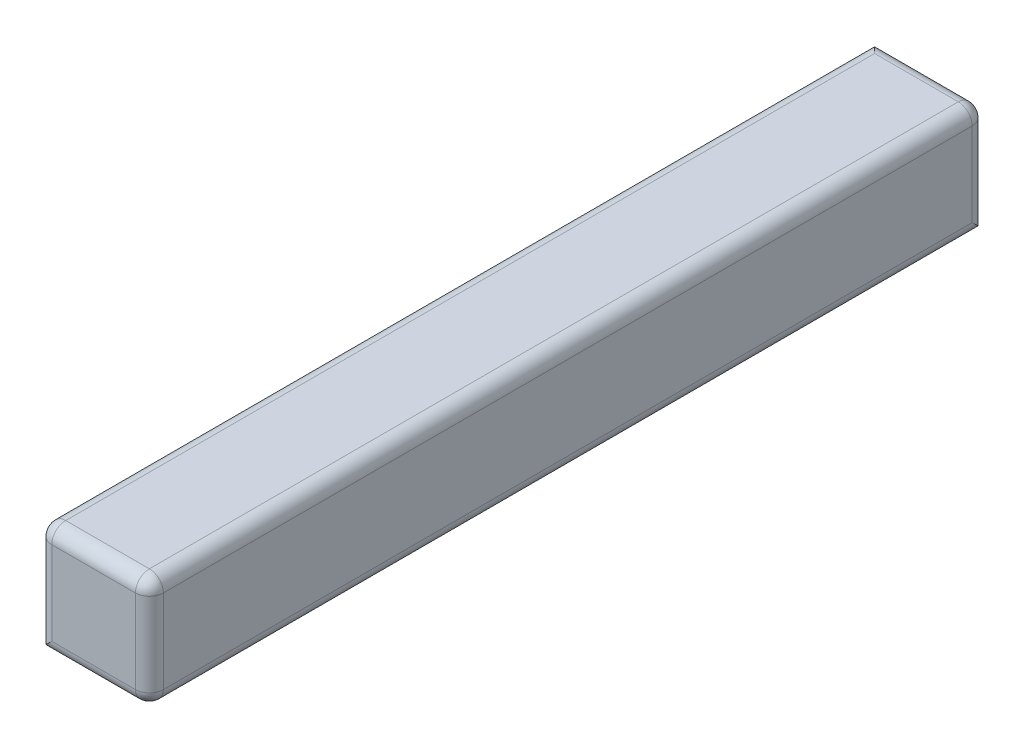
from build123d import *

# Parameters (mm, degrees)
SKETCH1_W           = 4
SKETCH1_H           = 30
BOSS_EXTRUDE1_DEPTH = 4
FILLET1_R           = 0.5


with BuildPart() as part:
    # Sketch1 → Boss-Extrude1 (new body)
    with BuildSketch(Plane(origin=(0, 0, 0), x_dir=(1, 0, 0), z_dir=(0, 1, 0))):
        with Locations((-14.966775932, -1.707317073)):
            Rectangle(SKETCH1_W, SKETCH1_H)
    extrude(amount=BOSS_EXTRUDE1_DEPTH)

    # Fillet1
    fillet1_edges = [part.edges().sort_by_distance(p)[0] for p in [
        (-12.966775932, 4, 1.707317073),
        (-14.966775932, 4, -13.292682927),
        (-16.966775932, 4, 1.707317073),
        (-12.966775932, 0, 1.707317073),
        (-14.966775932, 0, 16.707317073),
        (-14.966775932, 4, 16.707317073),
        (-12.966775932, 2, -13.292682927),
        (-12.966775932, 2, 16.707317073),
        (-16.966775932, 2, 16.707317073),
    ]]
    fillet(fillet1_edges, radius=FILLET1_R)


solid = part.part
